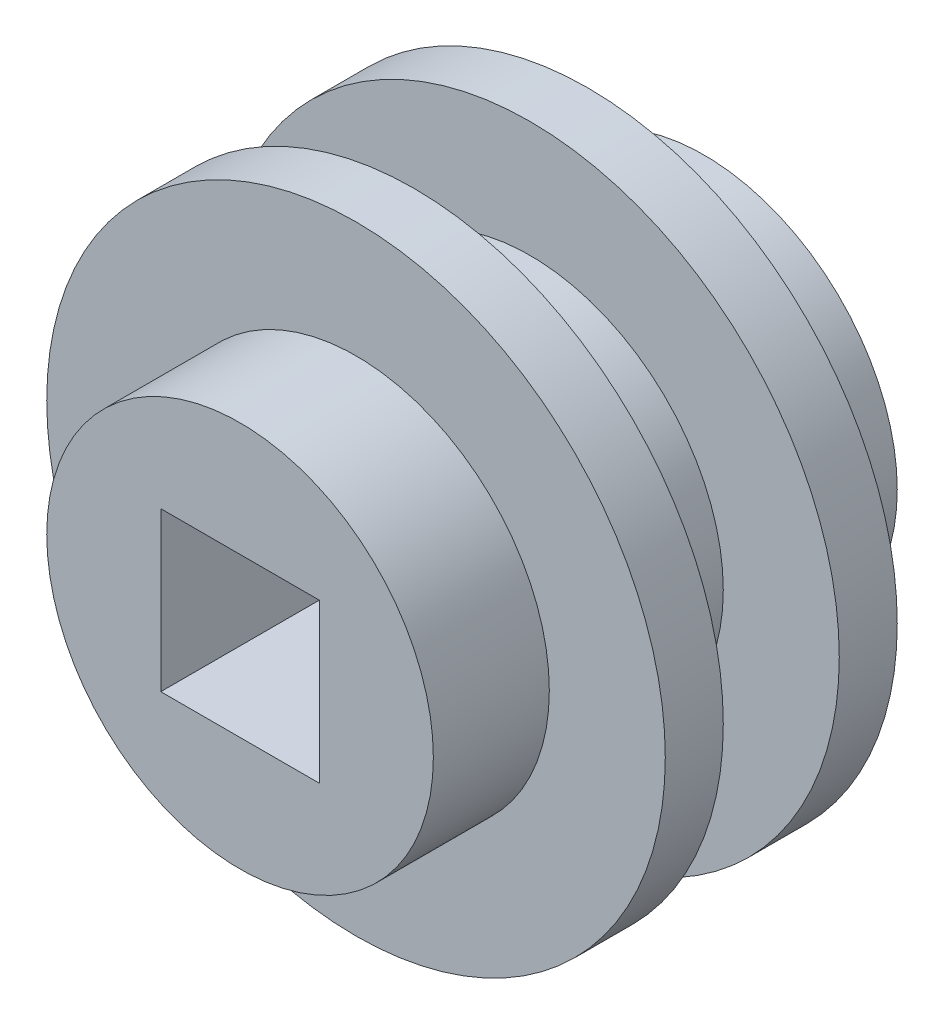
from build123d import *

# Parameters (mm, degrees)
SKETCH1_R               = 5
SKETCH1_W               = 4.1
SKETCH1_H               = 4.1
BOSS_EXTRUDE1_DEPTH     = 6
SKETCH1_3_R             = 8
SKETCH1_3_R_2           = 5
BOSS_EXTRUDE2_DEPTH     = 3
SKETCH1_6_R             = 8
SKETCH1_6_R_2           = 5
CUT_EXTRUDE_THIN1_DEPTH = 1.5


with BuildPart() as part:
    # Sketch1 → Boss-Extrude1 (new, symmetric)
    with BuildSketch(Plane.XY):
        Circle(SKETCH1_R)
        Rectangle(SKETCH1_W, SKETCH1_H, mode=Mode.SUBTRACT)
    extrude(amount=BOSS_EXTRUDE1_DEPTH, both=True)

    # Sketch1<3> → Boss-Extrude2 (add, symmetric)
    with BuildSketch(Plane.XY):
        Circle(SKETCH1_3_R)
        Circle(SKETCH1_3_R_2, mode=Mode.SUBTRACT)
    extrude(amount=BOSS_EXTRUDE2_DEPTH, both=True)

    # Sketch1<6> → Cut-Extrude-Thin1 (cut, symmetric)
    with BuildSketch(Plane.XY):
        Circle(SKETCH1_6_R)
        Circle(SKETCH1_6_R_2, mode=Mode.SUBTRACT)
    extrude(amount=CUT_EXTRUDE_THIN1_DEPTH, both=True, mode=Mode.SUBTRACT)


solid = part.part
